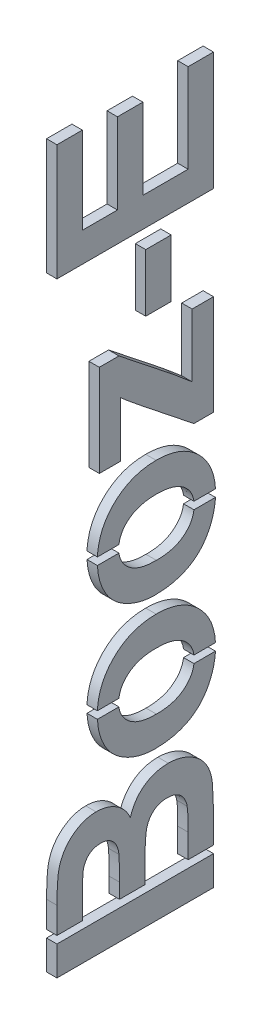
from build123d import *

# Parameters (mm, degrees)
SKETCH1_W             = 500
SKETCH1_H             = 100
SKETCH1_R             = 2.8
BOSS_EXTRUDE1_DEPTH   = 3.175
SKETCH2_W             = 17.846153846
SKETCH2_H             = 8
CUT_EXTRUDE1_DEPTH    = 255.970744645
SKETCH3_W             = 2
SKETCH3_H             = 48
SKETCH3_H_2           = 36.268634567
SKETCH3_H_3           = 36.26116394
BOSS_EXTRUDE4_DEPTH   = 3.175
SKETCH9_W             = 506.35
SKETCH9_H             = 106.35
SKETCH9_W_2           = 500
SKETCH9_H_2           = 100
BOSS_EXTRUDE5_DEPTH   = 3.175
SKETCH10_W            = 8.980769231
SKETCH10_H            = 47.75
BOSS_EXTRUDE6_DEPTH   = 3.175
BOSS_EXTRUDE6_2_DEPTH = 3.175
BOSS_EXTRUDE6_3_DEPTH = 3.175
BOSS_EXTRUDE6_4_DEPTH = 3.175
BOSS_EXTRUDE6_5_DEPTH = 3.175
BOSS_EXTRUDE6_6_DEPTH = 3.175
BOSS_EXTRUDE6_7_DEPTH = 3.175
SKETCH10_W_2          = 17.596153846
SKETCH10_H_2          = 7.75
BOSS_EXTRUDE6_8_DEPTH = 3.175
BOSS_EXTRUDE6_9_DEPTH = 3.175
SKETCH11_W            = 506.35
SKETCH11_H            = 106.35
SKETCH11_R            = 2.8
SKETCH11_W_2          = 17.846153846
SKETCH11_H_2          = 8
SKETCH11_W_3          = 9.230769231
SKETCH11_H_3          = 48
CUT_EXTRUDE2_DEPTH    = 259.718460758


with BuildPart() as part:
    # Sketch1 → Boss-Extrude1 (new body)
    with BuildSketch(Plane.YZ):
        Rectangle(SKETCH1_W, SKETCH1_H)
        with Locations(Location((-237.5, 37.5, 0), (0, 0, 270))):
            Circle(SKETCH1_R, mode=Mode.SUBTRACT)
        with Locations(Location((237.5, 37.5, 0), (0, 0, 90))):
            Circle(SKETCH1_R, mode=Mode.SUBTRACT)
        with Locations(Location((237.5, -37.5, 0), (0, 0, 270))):
            Circle(SKETCH1_R, mode=Mode.SUBTRACT)
        with Locations(Location((-237.5, -37.5, 0), (0, 0, 90))):
            Circle(SKETCH1_R, mode=Mode.SUBTRACT)
    extrude(amount=BOSS_EXTRUDE1_DEPTH)

    # Sketch2 → Cut-Extrude1 (cut, through all)
    # profile 1 of 6: a face of its own
    with BuildSketch(Plane.YZ.offset(3.175)):
        with BuildLine():
            Line((-210.076923077, 24), (-190.740384615, 24))
            add(Edge.make_bspline(
                [(-190.740384615, 24), (-189.843065051, 23.991908422), (-188.541064106, 23.993595131), (-186.868498546, 23.933344815), (-185.751963701, 23.895772861), (-184.730714073, 23.808020187), (-183.796726838, 23.739065687), (-182.952941804, 23.644206104), (-181.958941097, 23.490694087), (-180.803093852, 23.25191728), (-179.497592609, 22.810244633), (-178.260105749, 22.258417898), (-177.109232418, 21.556854635), (-176.041155113, 20.736332317), (-175.047684639, 19.803386409), (-174.174725455, 18.720317621), (-173.388402473, 17.538231121), (-172.725582471, 16.256137431), (-172.104890848, 14.393697304), (-171.921755444, 12.917736382), (-171.923076923, 11.923076923)],
                knots=[0, 0, 0, 0, 0.105884058, 0.15355278, 0.1974569, 0.237652956, 0.27445636, 0.307946195, 0.337787549, 0.393116516, 0.446925741, 0.500063811, 0.55265689, 0.60552249, 0.65874794, 0.713022825, 0.769236291, 0.82605694, 0.882736495, 1, 1, 1, 1], degree=3))
            add(Edge.make_bspline(
                [(-171.923076923, 11.923076923), (-171.915463906, 10.83301428), (-172.131712608, 9.202251646), (-172.869977029, 7.150731131), (-173.641339074, 5.714556228), (-174.588002252, 4.397681844), (-176.083139801, 2.845306621), (-177.447085264, 1.961092084), (-178.423076923, 1.509615385)],
                knots=[0, 0, 0, 0, 0.252157198, 0.376787363, 0.502925804, 0.62834201, 0.751131965, 1, 1, 1, 1], degree=3))
            add(Edge.make_bspline(
                [(-178.423076923, 1.509615385), (-177.777213356, 1.300151904), (-176.835669325, 0.941665951), (-175.670426869, 0.310338052), (-174.865992928, -0.205727581), (-174.114016682, -0.775352096), (-173.436393921, -1.417126022), (-172.794261967, -2.094613585), (-172.230518786, -2.84180196), (-171.720245482, -3.62295956), (-171.287097745, -4.450312253), (-170.91203502, -5.303958159), (-170.598336433, -6.192545318), (-170.374823195, -7.122000494), (-170.132722876, -8.415226734), (-170.090556654, -9.416126066), (-170.076923077, -10.086538462)],
                knots=[0, 0, 0, 0, 0.132556806, 0.195780264, 0.258216645, 0.318868125, 0.379477695, 0.440087264, 0.500738744, 0.56178533, 0.621918965, 0.682673484, 0.743575816, 0.805446126, 0.868974916, 1, 1, 1, 1], degree=3))
            add(Edge.make_bspline(
                [(-170.076923077, -10.086538462), (-170.083387247, -11.168561109), (-170.260616987, -12.808233718), (-170.90973872, -14.915330857), (-171.567710797, -16.463795065), (-172.386064411, -17.923894815), (-173.347888701, -19.256972165), (-174.470159676, -20.416821755), (-175.712942024, -21.439033269), (-177.113444272, -22.284468613), (-179.246749997, -23.178717765), (-180.989181459, -23.547596545), (-182.192307692, -23.673076923)],
                knots=[0, 0, 0, 0, 0.162134877, 0.244884357, 0.329396712, 0.41363605, 0.495043982, 0.574816901, 0.654648996, 0.735397766, 0.818838922, 1, 1, 1, 1], degree=3))
            add(Edge.make_bspline(
                [(-182.192307692, -23.673076923), (-182.736401215, -23.721395628), (-183.659076965, -23.787343646), (-185.031960642, -23.839150157), (-186.377926038, -23.890296562), (-187.938972286, -23.92702317), (-190.445451747, -23.963097063), (-192.432556734, -23.995709696), (-193.826923077, -24)],
                knots=[0, 0, 0, 0, 0.140766497, 0.238315848, 0.354022328, 0.487866729, 0.640687248, 1, 1, 1, 1], degree=3))
            Line((-193.826923077, -24), (-210.076923077, -24))
            Line((-210.076923077, -24), (-210.076923077, 24))
        make_face()
        with BuildLine():
            Line((-200.846153846, 16), (-200.846153846, 4.923076923))
            Line((-200.846153846, 4.923076923), (-194.163461538, 4.923076923))
            add(Edge.make_bspline(
                [(-194.163461538, 4.923076923), (-193.265983194, 4.915875878), (-191.990379912, 4.930337661), (-190.381340573, 4.93957842), (-189.384426502, 4.957564307), (-188.528734942, 4.987827365), (-187.672570496, 5.022841349), (-187.101425884, 5.048184339), (-186.769230769, 5.086538462)],
                knots=[0, 0, 0, 0, 0.363928509, 0.517301829, 0.652498452, 0.768239873, 0.864498693, 1, 1, 1, 1], degree=3))
            add(Edge.make_bspline(
                [(-186.769230769, 5.086538462), (-185.972953689, 5.18854668), (-184.810246839, 5.423950166), (-183.466913625, 6.131329055), (-182.634617275, 6.765255192), (-181.974579307, 7.543321504), (-181.309564485, 8.766521054), (-181.15885995, 9.829927363), (-181.153846154, 10.538461538)],
                knots=[0, 0, 0, 0, 0.279180569, 0.403146506, 0.522444612, 0.638838486, 0.753412678, 1, 1, 1, 1], degree=3))
            add(Edge.make_bspline(
                [(-181.153846154, 10.538461538), (-181.136832253, 11.22485139), (-181.29957954, 12.228650878), (-181.851571254, 13.428065696), (-182.434368937, 14.180691445), (-183.166681173, 14.816013153), (-184.419123766, 15.511045966), (-185.521816808, 15.731898255), (-186.278846154, 15.836538462)],
                knots=[0, 0, 0, 0, 0.250585524, 0.366013953, 0.47979182, 0.596199355, 0.718553119, 1, 1, 1, 1], degree=3))
            add(Edge.make_bspline(
                [(-186.278846154, 15.836538462), (-186.649529401, 15.876182244), (-187.294411246, 15.900453364), (-188.272324581, 15.935602406), (-189.272274829, 15.965626343), (-190.451863343, 15.983563344), (-192.378201793, 15.992746418), (-193.910220111, 16.007323291), (-194.990384615, 16)],
                knots=[0, 0, 0, 0, 0.128239885, 0.22208111, 0.336874893, 0.472602106, 0.628175186, 1, 1, 1, 1], degree=3))
            Line((-194.990384615, 16), (-200.846153846, 16))
        make_face(mode=Mode.SUBTRACT)
        with BuildLine():
            Line((-200.846153846, -3.076923077), (-200.846153846, -16))
            Line((-200.846153846, -16), (-191.423076923, -16))
            add(Edge.make_bspline(
                [(-191.423076923, -16), (-190.589503001, -16.015748033), (-189.400718209, -15.983284976), (-187.900229721, -15.969355508), (-186.961462853, -15.923986242), (-186.150260652, -15.88941373), (-185.317440608, -15.837620903), (-184.761249255, -15.756701108), (-184.432692308, -15.701923077)],
                knots=[0, 0, 0, 0, 0.356994199, 0.509418466, 0.642709622, 0.759541115, 0.857263317, 1, 1, 1, 1], degree=3))
            add(Edge.make_bspline(
                [(-184.432692308, -15.701923077), (-183.715416128, -15.586736145), (-182.688788528, -15.243238653), (-181.48217853, -14.497736793), (-180.712682663, -13.796744773), (-180.080988572, -12.956079881), (-179.448282758, -11.602091364), (-179.303535085, -10.451583543), (-179.307692308, -9.673076923)],
                knots=[0, 0, 0, 0, 0.250407824, 0.369282527, 0.487614715, 0.607842641, 0.730167532, 1, 1, 1, 1], degree=3))
            add(Edge.make_bspline(
                [(-179.307692308, -9.673076923), (-179.303593697, -8.992433722), (-179.427094789, -7.990636237), (-179.907580148, -6.769709557), (-180.394269917, -5.966106516), (-181.0030541, -5.242186838), (-181.755439529, -4.636375985), (-182.624137062, -4.131638431), (-183.452249399, -3.79912359), (-184.237517489, -3.585795337), (-184.98649789, -3.445848029), (-185.889172396, -3.335068231), (-186.941165418, -3.241365007), (-188.146742353, -3.166412878), (-190.056704665, -3.083302486), (-191.567391388, -3.081828146), (-192.625, -3.076923077)],
                knots=[0, 0, 0, 0, 0.12069588, 0.176255416, 0.231266923, 0.286442241, 0.34292522, 0.401445762, 0.463857631, 0.500356262, 0.54545082, 0.598687676, 0.661395797, 0.732507568, 0.812630315, 1, 1, 1, 1], degree=3))
            Line((-192.625, -3.076923077), (-200.846153846, -3.076923077))
        make_face(mode=Mode.SUBTRACT)
    # profile 2 of 6: a face of its own
    with BuildSketch(Plane.YZ.offset(3.175)):
        with BuildLine():
            Line((-84.538461538, -24), (-84.538461538, -17.846153846))
            Line((-84.538461538, -17.846153846), (-71.461538462, -1.413461538))
            add(Edge.make_bspline(
                [(-71.461538462, -1.413461538), (-70.968680564, -0.783264098), (-70.229006889, 0.104293194), (-69.301040807, 1.258289535), (-68.671014533, 2.004691465), (-68.108534999, 2.690928269), (-67.453655346, 3.449844943), (-66.989223126, 3.98220471), (-66.692307692, 4.307692308)],
                knots=[0, 0, 0, 0, 0.322142125, 0.465272934, 0.596329707, 0.715487367, 0.822590745, 1, 1, 1, 1], degree=3))
            add(Edge.make_bspline(
                [(-66.692307692, 4.307692308), (-67.314102564, 4.307692308), (-68.730769231, 4.307692308), (-70.147435897, 4.307692308), (-70.942307692, 4.307692308)],
                knots=[0, 0, 0, 0, 0.438914027, 1, 1, 1, 1], degree=3))
            Line((-70.942307692, 4.307692308), (-83.307692308, 4.307692308))
            Line((-83.307692308, 4.307692308), (-83.307692308, 11.076923077))
            Line((-83.307692308, 11.076923077), (-55, 11.076923077))
            Line((-55, 11.076923077), (-55, 4.923076923))
            Line((-55, 4.923076923), (-68.201923077, -11.721153846))
            Line((-68.201923077, -11.721153846), (-72.846153846, -17.230769231))
            add(Edge.make_bspline(
                [(-72.846153846, -17.230769231), (-72.266025641, -17.230769231), (-71.442307692, -17.230769231), (-70.403846154, -17.230769231), (-69.762820513, -17.230769231), (-69.211538462, -17.230769231), (-68.66025641, -17.230769231), (-68.291666667, -17.230769231), (-68.076923077, -17.230769231)],
                knots=[0, 0, 0, 0, 0.364919355, 0.518145161, 0.653225806, 0.768145161, 0.864919355, 1, 1, 1, 1], degree=3))
            Line((-68.076923077, -17.230769231), (-53.769230769, -17.230769231))
            Line((-53.769230769, -17.230769231), (-53.769230769, -24))
            Line((-53.769230769, -24), (-84.538461538, -24))
        make_face()
    # profile 3 of 6: a face of its own
    with BuildSketch(Plane.YZ.offset(3.175)):
        with Locations((-39.923076923, -7.076923077)):
            Rectangle(SKETCH2_W, SKETCH2_H)
    # profile 4 of 6: a face of its own
    with BuildSketch(Plane.YZ.offset(3.175)):
        Polygon((-25.461538462, -24), (-25.461538462, 24), (10.230769231, 24), (10.230769231, 16), (-16.230769231, 16), (-16.230769231, 5.538461538), (8.384615385, 5.538461538), (8.384615385, -2.461538462), (-16.230769231, -2.461538462), (-16.230769231, -16), (10.846153846, -16), (10.846153846, -24), align=None)
    # profile 5 of 6: a face of its own
    with BuildSketch(Plane.YZ.offset(3.175)):
        with BuildLine():
            add(Edge.make_bspline(
                [(-164.538461538, -5.971153846), (-164.525361513, -4.455317517), (-164.264537148, -2.163281886), (-163.308424405, 0.768298631), (-162.506991494, 2.560706395), (-161.714608168, 3.931023491), (-161.074833513, 4.919161747), (-160.360560995, 5.833066706), (-159.586448881, 6.678528358), (-158.769900339, 7.475815535), (-157.882166293, 8.195598007), (-156.934727536, 8.850278632), (-155.936835264, 9.447080268), (-154.889915965, 9.971086615), (-153.813405996, 10.436881562), (-152.702954653, 10.819583971), (-151.566300484, 11.137041797), (-150.398508466, 11.391313875), (-148.782959781, 11.617279135), (-147.550099305, 11.69127361), (-146.721153846, 11.692307692)],
                knots=[0, 0, 0, 0, 0.162140998, 0.244134843, 0.328745059, 0.371396388, 0.413193452, 0.454436775, 0.495169251, 0.535619967, 0.576273169, 0.617126418, 0.658595237, 0.700410539, 0.742144409, 0.783845942, 0.825811058, 0.868198922, 0.911452437, 1, 1, 1, 1], degree=3))
            add(Edge.make_bspline(
                [(-146.721153846, 11.692307692), (-145.465977639, 11.693835962), (-143.610306528, 11.55308647), (-141.239017431, 11.003471329), (-139.57908794, 10.442622985), (-138.006240805, 9.722838028), (-136.528418468, 8.828367842), (-135.133403514, 7.785232057), (-133.847599993, 6.587128465), (-132.672320476, 5.275273204), (-131.652994744, 3.857035149), (-130.783044963, 2.359847037), (-130.062318961, 0.781331629), (-129.516050354, -0.886851381), (-129.00008891, -3.265228826), (-128.8360265, -5.11179234), (-128.846153846, -6.365384615)],
                knots=[0, 0, 0, 0, 0.132301244, 0.195046012, 0.256021148, 0.316610756, 0.376897544, 0.437680691, 0.499809068, 0.561756395, 0.622955533, 0.683480177, 0.743929412, 0.805438003, 0.868033569, 1, 1, 1, 1], degree=3))
            add(Edge.make_bspline(
                [(-128.846153846, -6.365384615), (-128.838109068, -7.628073955), (-128.994839504, -9.492650718), (-129.525674058, -11.892357564), (-130.083142704, -13.577431468), (-130.802314715, -15.176396851), (-131.668485871, -16.694712098), (-132.70487118, -18.12439292), (-133.891530307, -19.450539706), (-135.19394404, -20.655199223), (-136.578940332, -21.726138324), (-138.063232002, -22.608966719), (-139.620782465, -23.351553883), (-141.267613718, -23.914256311), (-143.607339921, -24.462382631), (-145.428900561, -24.627527689), (-146.663461538, -24.615384615)],
                knots=[0, 0, 0, 0, 0.132664632, 0.195844471, 0.25795447, 0.318876286, 0.379842798, 0.441368954, 0.504122503, 0.56658146, 0.627628899, 0.687774491, 0.747753793, 0.808695168, 0.870308884, 1, 1, 1, 1], degree=3))
            add(Edge.make_bspline(
                [(-146.663461538, -24.615384615), (-148.224872266, -24.615861531), (-150.569113031, -24.349132398), (-153.574905536, -23.440786781), (-155.391067893, -22.662353022), (-156.778426398, -21.902162992), (-157.762303945, -21.262398306), (-158.690188927, -20.57577744), (-159.540370024, -19.807029757), (-160.327520426, -18.978218676), (-161.062067726, -18.097371864), (-161.717857085, -17.144156698), (-162.313206047, -16.135891562), (-162.847418632, -15.065369867), (-163.292766191, -13.92965059), (-163.679674279, -12.742073895), (-163.998851145, -11.499941745), (-164.235257512, -10.197933099), (-164.470167793, -8.353368236), (-164.535010955, -6.934047616), (-164.538461538, -5.971153846)],
                knots=[0, 0, 0, 0, 0.160511599, 0.240687016, 0.322168434, 0.363171868, 0.403209087, 0.442755033, 0.481726967, 0.520886552, 0.560212184, 0.599521244, 0.639706025, 0.680530285, 0.722388267, 0.765012415, 0.808893272, 0.854138877, 0.900982465, 1, 1, 1, 1], degree=3))
        make_face()
        with BuildLine():
            add(Edge.make_bspline(
                [(-155.307692308, -6.461538462), (-155.309052621, -7.32906199), (-155.238496188, -8.596139064), (-154.984773481, -10.22237118), (-154.70101741, -11.319716252), (-154.358471789, -12.343949535), (-153.923741539, -13.281448383), (-153.426962922, -14.149967862), (-152.835746517, -14.917020018), (-152.191376769, -15.596012636), (-151.516014558, -16.19934303), (-150.803037583, -16.71304933), (-150.048058922, -17.130796747), (-149.252040745, -17.447600841), (-148.136359479, -17.762599412), (-147.259542964, -17.840735718), (-146.673076923, -17.846153846)],
                knots=[0, 0, 0, 0, 0.162282734, 0.237014737, 0.307558049, 0.374124876, 0.438795352, 0.500611131, 0.560942973, 0.619486829, 0.675564498, 0.730150481, 0.783564296, 0.836572585, 0.890117536, 1, 1, 1, 1], degree=3))
            add(Edge.make_bspline(
                [(-146.673076923, -17.846153846), (-146.086416968, -17.841215563), (-145.210167854, -17.76167521), (-144.096438585, -17.449745751), (-143.305572416, -17.128207375), (-142.552548071, -16.713427991), (-141.840014813, -16.198999325), (-141.165139764, -15.598501089), (-140.526009944, -14.915845202), (-139.951898527, -14.138348546), (-139.450252193, -13.272540339), (-139.015533992, -12.33145315), (-138.67141092, -11.301785869), (-138.403199784, -10.191817138), (-138.143126798, -8.551855675), (-138.076617205, -7.271010511), (-138.076923077, -6.394230769)],
                knots=[0, 0, 0, 0, 0.109603407, 0.163012375, 0.215331594, 0.26860976, 0.323057116, 0.37899237, 0.436978637, 0.497276061, 0.558934853, 0.623441092, 0.690404991, 0.761205129, 0.836337828, 1, 1, 1, 1], degree=3))
            add(Edge.make_bspline(
                [(-138.076923077, -6.394230769), (-138.077306172, -5.536811351), (-138.141641272, -4.284122394), (-138.405766296, -2.677176681), (-138.66935341, -1.585271347), (-139.017319447, -0.569468954), (-139.452974194, 0.360822605), (-139.948600098, 1.224111258), (-140.529365853, 1.993471995), (-141.164733849, 2.675723073), (-141.840118827, 3.275845808), (-142.552521163, 3.790370883), (-143.305579409, 4.205125302), (-144.096436692, 4.526670222), (-145.210169164, 4.838597323), (-146.086416288, 4.918139141), (-146.673076923, 4.923076923)],
                knots=[0, 0, 0, 0, 0.16138657, 0.235346324, 0.306137922, 0.372506886, 0.436991515, 0.499153027, 0.559458553, 0.617917599, 0.674308908, 0.729200189, 0.782912747, 0.835658539, 0.889502966, 1, 1, 1, 1], degree=3))
            add(Edge.make_bspline(
                [(-146.673076923, 4.923076923), (-147.259542964, 4.917658794), (-148.136359479, 4.839522489), (-149.252040745, 4.524523918), (-150.048058922, 4.207719824), (-150.803037583, 3.789972407), (-151.516014558, 3.276266107), (-152.191376769, 2.672935713), (-152.835746517, 1.993943095), (-153.426962922, 1.226890939), (-153.923741539, 0.35837146), (-154.358471789, -0.579127388), (-154.70101741, -1.603360671), (-154.984773481, -2.700705743), (-155.238496188, -4.326937859), (-155.309052621, -5.594014933), (-155.307692308, -6.461538462)],
                knots=[0, 0, 0, 0, 0.109882464, 0.163427415, 0.216435704, 0.269849519, 0.324435502, 0.380513171, 0.439057027, 0.499388869, 0.561204648, 0.625875124, 0.692441951, 0.762985263, 0.837717266, 1, 1, 1, 1], degree=3))
        make_face(mode=Mode.SUBTRACT)
    # profile 6 of 6: a face of its own
    with BuildSketch(Plane.YZ.offset(3.175)):
        with BuildLine():
            add(Edge.make_bspline(
                [(-123.923076923, -5.971153846), (-123.909976897, -4.455317517), (-123.649152532, -2.163281886), (-122.69303979, 0.768298631), (-121.891606879, 2.560706395), (-121.099223553, 3.931023491), (-120.459448898, 4.919161747), (-119.745176379, 5.833066706), (-118.971064266, 6.678528358), (-118.154515723, 7.475815535), (-117.266781678, 8.195598007), (-116.31934292, 8.850278632), (-115.321450649, 9.447080268), (-114.27453135, 9.971086615), (-113.198021381, 10.436881562), (-112.087570038, 10.819583971), (-110.950915869, 11.137041797), (-109.783123851, 11.391313875), (-108.167575165, 11.617279135), (-106.934714689, 11.69127361), (-106.105769231, 11.692307692)],
                knots=[0, 0, 0, 0, 0.162140998, 0.244134843, 0.328745059, 0.371396388, 0.413193452, 0.454436775, 0.495169251, 0.535619967, 0.576273169, 0.617126418, 0.658595237, 0.700410539, 0.742144409, 0.783845942, 0.825811058, 0.868198922, 0.911452437, 1, 1, 1, 1], degree=3))
            add(Edge.make_bspline(
                [(-106.105769231, 11.692307692), (-104.850593024, 11.693835962), (-102.994921913, 11.55308647), (-100.623632816, 11.003471329), (-98.963703324, 10.442622985), (-97.390856189, 9.722838028), (-95.913033852, 8.828367842), (-94.518018899, 7.785232057), (-93.232215378, 6.587128465), (-92.056935861, 5.275273204), (-91.037610129, 3.857035149), (-90.167660348, 2.359847037), (-89.446934346, 0.781331629), (-88.900665739, -0.886851381), (-88.384704295, -3.265228826), (-88.220641884, -5.11179234), (-88.230769231, -6.365384615)],
                knots=[0, 0, 0, 0, 0.132301244, 0.195046012, 0.256021148, 0.316610756, 0.376897544, 0.437680691, 0.499809068, 0.561756395, 0.622955533, 0.683480177, 0.743929412, 0.805438003, 0.868033569, 1, 1, 1, 1], degree=3))
            add(Edge.make_bspline(
                [(-88.230769231, -6.365384615), (-88.222724453, -7.628073955), (-88.379454888, -9.492650718), (-88.910289443, -11.892357564), (-89.467758089, -13.577431468), (-90.1869301, -15.176396851), (-91.053101255, -16.694712098), (-92.089486564, -18.12439292), (-93.276145691, -19.450539706), (-94.578559425, -20.655199223), (-95.963555717, -21.726138324), (-97.447847386, -22.608966719), (-99.00539785, -23.351553883), (-100.652229103, -23.914256311), (-102.991955306, -24.462382631), (-104.813515946, -24.627527689), (-106.048076923, -24.615384615)],
                knots=[0, 0, 0, 0, 0.132664632, 0.195844471, 0.25795447, 0.318876286, 0.379842798, 0.441368954, 0.504122503, 0.56658146, 0.627628899, 0.687774491, 0.747753793, 0.808695168, 0.870308884, 1, 1, 1, 1], degree=3))
            add(Edge.make_bspline(
                [(-106.048076923, -24.615384615), (-107.60948765, -24.615861531), (-109.953728415, -24.349132398), (-112.959520921, -23.440786781), (-114.775683278, -22.662353022), (-116.163041782, -21.902162992), (-117.146919329, -21.262398306), (-118.074804312, -20.57577744), (-118.924985409, -19.807029757), (-119.712135811, -18.978218676), (-120.44668311, -18.097371864), (-121.10247247, -17.144156698), (-121.697821432, -16.135891562), (-122.232034016, -15.065369867), (-122.677381575, -13.92965059), (-123.064289663, -12.742073895), (-123.383466529, -11.499941745), (-123.619872896, -10.197933099), (-123.854783178, -8.353368236), (-123.919626339, -6.934047616), (-123.923076923, -5.971153846)],
                knots=[0, 0, 0, 0, 0.160511599, 0.240687016, 0.322168434, 0.363171868, 0.403209087, 0.442755033, 0.481726967, 0.520886552, 0.560212184, 0.599521244, 0.639706025, 0.680530285, 0.722388267, 0.765012415, 0.808893272, 0.854138877, 0.900982465, 1, 1, 1, 1], degree=3))
        make_face()
        with BuildLine():
            add(Edge.make_bspline(
                [(-114.692307692, -6.461538462), (-114.693668006, -7.32906199), (-114.623111573, -8.596139064), (-114.369388865, -10.22237118), (-114.085632794, -11.319716252), (-113.743087174, -12.343949535), (-113.308356923, -13.281448383), (-112.811578307, -14.149967862), (-112.220361902, -14.917020018), (-111.575992154, -15.596012636), (-110.900629943, -16.19934303), (-110.187652968, -16.71304933), (-109.432674307, -17.130796747), (-108.636656129, -17.447600841), (-107.520974864, -17.762599412), (-106.644158348, -17.840735718), (-106.057692308, -17.846153846)],
                knots=[0, 0, 0, 0, 0.162282734, 0.237014737, 0.307558049, 0.374124876, 0.438795352, 0.500611131, 0.560942973, 0.619486829, 0.675564498, 0.730150481, 0.783564296, 0.836572585, 0.890117536, 1, 1, 1, 1], degree=3))
            add(Edge.make_bspline(
                [(-106.057692308, -17.846153846), (-105.471032353, -17.841215563), (-104.594783239, -17.76167521), (-103.481053969, -17.449745751), (-102.690187801, -17.128207375), (-101.937163455, -16.713427991), (-101.224630198, -16.198999325), (-100.549755149, -15.598501089), (-99.910625329, -14.915845202), (-99.336513912, -14.138348546), (-98.834867577, -13.272540339), (-98.400149376, -12.33145315), (-98.056026304, -11.301785869), (-97.787815169, -10.191817138), (-97.527742182, -8.551855675), (-97.46123259, -7.271010511), (-97.461538462, -6.394230769)],
                knots=[0, 0, 0, 0, 0.109603407, 0.163012375, 0.215331594, 0.26860976, 0.323057116, 0.37899237, 0.436978637, 0.497276061, 0.558934853, 0.623441092, 0.690404991, 0.761205129, 0.836337828, 1, 1, 1, 1], degree=3))
            add(Edge.make_bspline(
                [(-97.461538462, -6.394230769), (-97.461921557, -5.536811351), (-97.526256656, -4.284122394), (-97.790381681, -2.677176681), (-98.053968795, -1.585271347), (-98.401934831, -0.569468954), (-98.837589578, 0.360822605), (-99.333215483, 1.224111258), (-99.913981238, 1.993471995), (-100.549349233, 2.675723073), (-101.224734212, 3.275845808), (-101.937136547, 3.790370883), (-102.690194794, 4.205125302), (-103.481052077, 4.526670222), (-104.594784548, 4.838597323), (-105.471031673, 4.918139141), (-106.057692308, 4.923076923)],
                knots=[0, 0, 0, 0, 0.16138657, 0.235346324, 0.306137922, 0.372506886, 0.436991515, 0.499153027, 0.559458553, 0.617917599, 0.674308908, 0.729200189, 0.782912747, 0.835658539, 0.889502966, 1, 1, 1, 1], degree=3))
            add(Edge.make_bspline(
                [(-106.057692308, 4.923076923), (-106.644158348, 4.917658794), (-107.520974864, 4.839522489), (-108.636656129, 4.524523918), (-109.432674307, 4.207719824), (-110.187652968, 3.789972407), (-110.900629943, 3.276266107), (-111.575992154, 2.672935713), (-112.220361902, 1.993943095), (-112.811578307, 1.226890939), (-113.308356923, 0.35837146), (-113.743087174, -0.579127388), (-114.085632794, -1.603360671), (-114.369388865, -2.700705743), (-114.623111573, -4.326937859), (-114.693668006, -5.594014933), (-114.692307692, -6.461538462)],
                knots=[0, 0, 0, 0, 0.109882464, 0.163427415, 0.216435704, 0.269849519, 0.324435502, 0.380513171, 0.439057027, 0.499388869, 0.561204648, 0.625875124, 0.692441951, 0.762985263, 0.837717266, 1, 1, 1, 1], degree=3))
        make_face(mode=Mode.SUBTRACT)
    extrude(amount=-CUT_EXTRUDE1_DEPTH, mode=Mode.SUBTRACT)


with BuildPart() as cut_extrude1_piece_1:
    # of the separate pieces the step leaves, piece 1, a body of its own (cut_extrude1_pieces)
    add(part.part.solids().sort_by_distance((0, -250, -50))[0])



with BuildPart() as cut_extrude1_piece_2:
    # of the separate pieces the step leaves, piece 2, a body of its own (cut_extrude1_pieces)
    add(part.part.solids().sort_by_distance((0, -106.057692308, -17.846153846))[0])


with BuildPart() as cut_extrude1_piece_3:
    # of the separate pieces the step leaves, piece 3, a body of its own (cut_extrude1_pieces)
    add(part.part.solids().sort_by_distance((0, -146.673076923, -17.846153846))[0])


with BuildPart() as cut_extrude1_piece_4:
    # of the separate pieces the step leaves, piece 4, a body of its own (cut_extrude1_pieces)
    add(part.part.solids().sort_by_distance((0, -192.625, -3.076923077))[0])


with BuildPart() as cut_extrude1_piece_5:
    # of the separate pieces the step leaves, piece 5, a body of its own (cut_extrude1_pieces)
    add(part.part.solids().sort_by_distance((0, -194.990384615, 16))[0])


with BuildPart() as cut_extrude1_piece_1_1:
    add(cut_extrude1_piece_1.part)

    add(cut_extrude1_piece_2.part)  # Boss-Extrude4 merges Cut-Extrude1 piece 2

    add(cut_extrude1_piece_3.part)  # Boss-Extrude4 merges Cut-Extrude1 piece 3

    add(cut_extrude1_piece_4.part)  # Boss-Extrude4 merges Cut-Extrude1 piece 4

    add(cut_extrude1_piece_5.part)  # Boss-Extrude4 merges Cut-Extrude1 piece 5
    # Sketch3 → Boss-Extrude4 (add, through all)
    with BuildSketch(Plane.YZ.offset(3.175)):
        with Locations((-199.846153846, 0)):
            Rectangle(SKETCH3_W, SKETCH3_H)
        with Locations((-146.673076923, -6.464343088)):
            Rectangle(SKETCH3_W, SKETCH3_H_2)
        with Locations((-106.057692308, -6.460196748)):
            Rectangle(SKETCH3_W, SKETCH3_H_3)
    extrude(amount=-BOSS_EXTRUDE4_DEPTH)

    # Sketch9 → Boss-Extrude5 (add, through all)
    with BuildSketch(Plane.YZ.offset(3.175)):
        Rectangle(SKETCH9_W, SKETCH9_H)
        Rectangle(SKETCH9_W_2, SKETCH9_H_2, mode=Mode.SUBTRACT)
    extrude(amount=-BOSS_EXTRUDE5_DEPTH)

    # Sketch11 → Cut-Extrude2 (cut, through all)
    with BuildSketch(Plane.YZ.offset(3.175)):
        Rectangle(SKETCH11_W, SKETCH11_H)
        with Locations((-237.5, -37.5)):
            Circle(SKETCH11_R, mode=Mode.SUBTRACT)
        with Locations((237.5, 37.5)):
            Circle(SKETCH11_R, mode=Mode.SUBTRACT)
        with Locations((-237.5, 37.5)):
            Circle(SKETCH11_R, mode=Mode.SUBTRACT)
        with Locations((237.5, -37.5)):
            Circle(SKETCH11_R, mode=Mode.SUBTRACT)
        with BuildLine():
            Line((-147.673076923, 4.863517403), (-147.673076923, 11.669974196))
            add(Edge.make_bspline(
                [(-147.673076923, 11.669974196), (-148.183854796, 11.646774057), (-149.097495463, 11.573285328), (-150.398508466, 11.391313875), (-151.566300484, 11.137041797), (-152.702954653, 10.819583971), (-153.813405996, 10.436881562), (-154.889915965, 9.971086615), (-155.936835264, 9.447080268), (-156.934727536, 8.850278632), (-157.882166293, 8.195598007), (-158.769900339, 7.475815535), (-159.586448881, 6.678528358), (-160.360560995, 5.833066706), (-161.074833513, 4.919161747), (-161.714608168, 3.931023491), (-162.506991494, 2.560706395), (-163.308424405, 0.768298631), (-164.264537148, -2.163281886), (-164.525361513, -4.455317517), (-164.538461538, -5.971153846)],
                knots=[0, 0, 0, 0, 0.056552102, 0.101323981, 0.145199821, 0.188638072, 0.231803488, 0.275002376, 0.318285555, 0.361210088, 0.403497442, 0.445577727, 0.487448418, 0.529610758, 0.57230188, 0.61556618, 0.659714734, 0.747295092, 0.832167233, 1, 1, 1, 1], degree=3))
            add(Edge.make_bspline(
                [(-164.538461538, -5.971153846), (-164.535010955, -6.934047616), (-164.470167793, -8.353368236), (-164.235257512, -10.197933099), (-163.998851145, -11.499941745), (-163.679674279, -12.742073895), (-163.292766191, -13.92965059), (-162.847418632, -15.065369867), (-162.313206047, -16.135891562), (-161.717857085, -17.144156698), (-161.062067726, -18.097371864), (-160.327520426, -18.978218676), (-159.540370024, -19.807029757), (-158.690188927, -20.57577744), (-157.762303945, -21.262398306), (-156.778426398, -21.902162992), (-155.391067893, -22.662353022), (-153.574905536, -23.440786781), (-150.891948444, -24.25157206), (-148.896871631, -24.530656123), (-147.673076923, -24.590778718)],
                knots=[0, 0, 0, 0, 0.102566576, 0.151089158, 0.197956481, 0.243410139, 0.287562045, 0.330920325, 0.37320783, 0.414832936, 0.455550933, 0.496286096, 0.53684926, 0.577218048, 0.618181421, 0.659653676, 0.702126778, 0.786528698, 0.869577806, 1, 1, 1, 1], degree=3))
            Line((-147.673076923, -24.590778718), (-147.673076923, -17.786594326))
            add(Edge.make_bspline(
                [(-147.673076923, -17.786594326), (-147.924973028, -17.757643261), (-148.458442284, -17.671663384), (-149.252040745, -17.447600841), (-150.048058922, -17.130796747), (-150.803037583, -16.71304933), (-151.516014558, -16.19934303), (-152.191376769, -15.596012636), (-152.835746517, -14.917020018), (-153.426962922, -14.149967862), (-153.923741539, -13.281448383), (-154.358471789, -12.343949535), (-154.70101741, -11.319716252), (-154.984773481, -10.22237118), (-155.238496188, -8.596139064), (-155.309052621, -7.32906199), (-155.307692308, -6.461538462)],
                knots=[0, 0, 0, 0, 0.050559323, 0.107672853, 0.164213954, 0.221187609, 0.279411551, 0.339226595, 0.40167219, 0.466024933, 0.531960512, 0.600941043, 0.67194431, 0.747189081, 0.826901703, 1, 1, 1, 1], degree=3))
            add(Edge.make_bspline(
                [(-155.307692308, -6.461538462), (-155.309052621, -5.594014933), (-155.238496188, -4.326937859), (-154.984773481, -2.700705743), (-154.70101741, -1.603360671), (-154.358471789, -0.579127388), (-153.923741539, 0.35837146), (-153.426962922, 1.226890939), (-152.835746517, 1.993943095), (-152.191376769, 2.672935713), (-151.516014558, 3.276266107), (-150.803037583, 3.789972407), (-150.048058922, 4.207719824), (-149.252040745, 4.524523918), (-148.458442284, 4.748586461), (-147.924973028, 4.834566338), (-147.673076923, 4.863517403)],
                knots=[0, 0, 0, 0, 0.173098297, 0.252810919, 0.32805569, 0.399058957, 0.468039488, 0.533975067, 0.59832781, 0.660773405, 0.720588449, 0.778812391, 0.835786046, 0.892327147, 0.949440677, 1, 1, 1, 1], degree=3))
        make_face(mode=Mode.SUBTRACT)
        Polygon((10.846153846, -24), (10.846153846, -16), (-16.230769231, -16), (-16.230769231, -2.461538462), (8.384615385, -2.461538462), (8.384615385, 5.538461538), (-16.230769231, 5.538461538), (-16.230769231, 16), (10.230769231, 16), (10.230769231, 24), (-25.461538462, 24), (-25.461538462, -24), align=None, mode=Mode.SUBTRACT)
        with Locations((-39.923076923, -7.076923077)):
            Rectangle(SKETCH11_W_2, SKETCH11_H_2, mode=Mode.SUBTRACT)
        with BuildLine():
            Line((-53.769230769, -24), (-53.769230769, -17.230769231))
            Line((-53.769230769, -17.230769231), (-68.076923077, -17.230769231))
            Line((-68.076923077, -17.230769231), (-72.846153846, -17.230769231))
            Line((-72.846153846, -17.230769231), (-68.201923077, -11.721153846))
            Line((-68.201923077, -11.721153846), (-55, 4.923076923))
            Line((-55, 4.923076923), (-55, 11.076923077))
            Line((-55, 11.076923077), (-83.307692308, 11.076923077))
            Line((-83.307692308, 11.076923077), (-83.307692308, 4.307692308))
            Line((-83.307692308, 4.307692308), (-70.942307692, 4.307692308))
            Line((-70.942307692, 4.307692308), (-66.692307692, 4.307692308))
            add(Edge.make_bspline(
                [(-66.692307692, 4.307692308), (-66.989223126, 3.98220471), (-67.453655346, 3.449844943), (-68.108534999, 2.690928269), (-68.671014533, 2.004691465), (-69.301040807, 1.258289535), (-70.229006889, 0.104293194), (-70.968680564, -0.783264098), (-71.461538462, -1.413461538)],
                knots=[0, 0, 0, 0, 0.177409255, 0.284512633, 0.403670293, 0.534727066, 0.677857875, 1, 1, 1, 1], degree=3))
            Line((-71.461538462, -1.413461538), (-84.538461538, -17.846153846))
            Line((-84.538461538, -17.846153846), (-84.538461538, -24))
            Line((-84.538461538, -24), (-53.769230769, -24))
        make_face(mode=Mode.SUBTRACT)
        with BuildLine():
            Line((-198.846153846, 4.923076923), (-198.846153846, -3.076923077))
            Line((-198.846153846, -3.076923077), (-192.625, -3.076923077))
            add(Edge.make_bspline(
                [(-192.625, -3.076923077), (-191.567391388, -3.081828146), (-190.056704665, -3.083302486), (-188.146742353, -3.166412878), (-186.941165418, -3.241365007), (-185.889172396, -3.335068231), (-184.98649789, -3.445848029), (-184.237517489, -3.585795337), (-183.452249399, -3.79912359), (-182.624137062, -4.131638431), (-181.755439529, -4.636375985), (-181.0030541, -5.242186838), (-180.394269917, -5.966106516), (-179.907580148, -6.769709557), (-179.427094789, -7.990636237), (-179.303593697, -8.992433722), (-179.307692308, -9.673076923)],
                knots=[0, 0, 0, 0, 0.187369685, 0.267492432, 0.338604203, 0.401312324, 0.45454918, 0.499643738, 0.536142369, 0.598554238, 0.65707478, 0.713557759, 0.768733077, 0.823744584, 0.87930412, 1, 1, 1, 1], degree=3))
            add(Edge.make_bspline(
                [(-179.307692308, -9.673076923), (-179.303535085, -10.451583543), (-179.448282758, -11.602091364), (-180.080988572, -12.956079881), (-180.712682663, -13.796744773), (-181.48217853, -14.497736793), (-182.688788528, -15.243238653), (-183.715416128, -15.586736145), (-184.432692308, -15.701923077)],
                knots=[0, 0, 0, 0, 0.269832468, 0.392157359, 0.512385285, 0.630717473, 0.749592176, 1, 1, 1, 1], degree=3))
            add(Edge.make_bspline(
                [(-184.432692308, -15.701923077), (-184.761249255, -15.756701108), (-185.317440608, -15.837620903), (-186.150260652, -15.88941373), (-186.961462853, -15.923986242), (-187.900229721, -15.969355508), (-189.400718209, -15.983284976), (-190.589503001, -16.015748033), (-191.423076923, -16)],
                knots=[0, 0, 0, 0, 0.142736683, 0.240458885, 0.357290378, 0.490581534, 0.643005801, 1, 1, 1, 1], degree=3))
            Line((-191.423076923, -16), (-198.846153846, -16))
            Line((-198.846153846, -16), (-198.846153846, -24))
            Line((-198.846153846, -24), (-193.826923077, -24))
            add(Edge.make_bspline(
                [(-193.826923077, -24), (-192.432556734, -23.995709696), (-190.445451747, -23.963097063), (-187.938972286, -23.92702317), (-186.377926038, -23.890296562), (-185.031960642, -23.839150157), (-183.659076965, -23.787343646), (-182.736401215, -23.721395628), (-182.192307692, -23.673076923)],
                knots=[0, 0, 0, 0, 0.359312752, 0.512133271, 0.645977672, 0.761684152, 0.859233503, 1, 1, 1, 1], degree=3))
            add(Edge.make_bspline(
                [(-182.192307692, -23.673076923), (-180.989181459, -23.547596545), (-179.246749997, -23.178717765), (-177.113444272, -22.284468613), (-175.712942024, -21.439033269), (-174.470159676, -20.416821755), (-173.347888701, -19.256972165), (-172.386064411, -17.923894815), (-171.567710797, -16.463795065), (-170.90973872, -14.915330857), (-170.260616987, -12.808233718), (-170.083387247, -11.168561109), (-170.076923077, -10.086538462)],
                knots=[0, 0, 0, 0, 0.181161078, 0.264602234, 0.345351004, 0.425183099, 0.504956018, 0.58636395, 0.670603288, 0.755115643, 0.837865123, 1, 1, 1, 1], degree=3))
            add(Edge.make_bspline(
                [(-170.076923077, -10.086538462), (-170.090556654, -9.416126066), (-170.132722876, -8.415226734), (-170.374823195, -7.122000494), (-170.598336433, -6.192545318), (-170.91203502, -5.303958159), (-171.287097745, -4.450312253), (-171.720245482, -3.62295956), (-172.230518786, -2.84180196), (-172.794261967, -2.094613585), (-173.436393921, -1.417126022), (-174.114016682, -0.775352096), (-174.865992928, -0.205727581), (-175.670426869, 0.310338052), (-176.835669325, 0.941665951), (-177.777213356, 1.300151904), (-178.423076923, 1.509615385)],
                knots=[0, 0, 0, 0, 0.131025084, 0.194553874, 0.256424184, 0.317326516, 0.378081035, 0.43821467, 0.499261256, 0.559912736, 0.620522305, 0.681131875, 0.741783355, 0.804219736, 0.867443194, 1, 1, 1, 1], degree=3))
            add(Edge.make_bspline(
                [(-178.423076923, 1.509615385), (-177.447085264, 1.961092084), (-176.083139801, 2.845306621), (-174.588002252, 4.397681844), (-173.641339074, 5.714556228), (-172.869977029, 7.150731131), (-172.131712608, 9.202251646), (-171.915463906, 10.83301428), (-171.923076923, 11.923076923)],
                knots=[0, 0, 0, 0, 0.248868035, 0.37165799, 0.497074196, 0.623212637, 0.747842802, 1, 1, 1, 1], degree=3))
            add(Edge.make_bspline(
                [(-171.923076923, 11.923076923), (-171.921755444, 12.917736382), (-172.104890848, 14.393697304), (-172.725582471, 16.256137431), (-173.388402473, 17.538231121), (-174.174725455, 18.720317621), (-175.047684639, 19.803386409), (-176.041155113, 20.736332317), (-177.109232418, 21.556854635), (-178.260105749, 22.258417898), (-179.497592609, 22.810244633), (-180.803093852, 23.25191728), (-181.958941097, 23.490694087), (-182.952941804, 23.644206104), (-183.796726838, 23.739065687), (-184.730714073, 23.808020187), (-185.751963701, 23.895772861), (-186.868498546, 23.933344815), (-188.541064106, 23.993595131), (-189.843065051, 23.991908422), (-190.740384615, 24)],
                knots=[0, 0, 0, 0, 0.117263505, 0.17394306, 0.230763709, 0.286977175, 0.34125206, 0.39447751, 0.44734311, 0.499936189, 0.553074259, 0.606883484, 0.662212451, 0.692053805, 0.72554364, 0.762347044, 0.8025431, 0.84644722, 0.894115942, 1, 1, 1, 1], degree=3))
            Line((-190.740384615, 24), (-198.846153846, 24))
            Line((-198.846153846, 24), (-198.846153846, 16))
            Line((-198.846153846, 16), (-194.990384615, 16))
            add(Edge.make_bspline(
                [(-194.990384615, 16), (-193.910220111, 16.007323291), (-192.378201793, 15.992746418), (-190.451863343, 15.983563344), (-189.272274829, 15.965626343), (-188.272324581, 15.935602406), (-187.294411246, 15.900453364), (-186.649529401, 15.876182244), (-186.278846154, 15.836538462)],
                knots=[0, 0, 0, 0, 0.371824814, 0.527397894, 0.663125107, 0.77791889, 0.871760115, 1, 1, 1, 1], degree=3))
            add(Edge.make_bspline(
                [(-186.278846154, 15.836538462), (-185.521816808, 15.731898255), (-184.419123766, 15.511045966), (-183.166681173, 14.816013153), (-182.434368937, 14.180691445), (-181.851571254, 13.428065696), (-181.29957954, 12.228650878), (-181.136832253, 11.22485139), (-181.153846154, 10.538461538)],
                knots=[0, 0, 0, 0, 0.281446881, 0.403800645, 0.52020818, 0.633986047, 0.749414476, 1, 1, 1, 1], degree=3))
            add(Edge.make_bspline(
                [(-181.153846154, 10.538461538), (-181.15885995, 9.829927363), (-181.309564485, 8.766521054), (-181.974579307, 7.543321504), (-182.634617275, 6.765255192), (-183.466913625, 6.131329055), (-184.810246839, 5.423950166), (-185.972953689, 5.18854668), (-186.769230769, 5.086538462)],
                knots=[0, 0, 0, 0, 0.246587322, 0.361161514, 0.477555388, 0.596853494, 0.720819431, 1, 1, 1, 1], degree=3))
            add(Edge.make_bspline(
                [(-186.769230769, 5.086538462), (-187.101425884, 5.048184339), (-187.672570496, 5.022841349), (-188.528734942, 4.987827365), (-189.384426502, 4.957564307), (-190.381340573, 4.93957842), (-191.990379912, 4.930337661), (-193.265983194, 4.915875878), (-194.163461538, 4.923076923)],
                knots=[0, 0, 0, 0, 0.135501307, 0.231760127, 0.347501548, 0.482698171, 0.636071491, 1, 1, 1, 1], degree=3))
            Line((-194.163461538, 4.923076923), (-198.846153846, 4.923076923))
        make_face(mode=Mode.SUBTRACT)
        with Locations((-205.461538462, 0)):
            Rectangle(SKETCH11_W_3, SKETCH11_H_3, mode=Mode.SUBTRACT)
        with BuildLine():
            Line((-105.057692308, -17.786550461), (-105.057692308, -24.598660371))
            add(Edge.make_bspline(
                [(-105.057692308, -24.598660371), (-104.154399527, -24.559391005), (-102.670164042, -24.386996775), (-100.652229103, -23.914256311), (-99.00539785, -23.351553883), (-97.447847386, -22.608966719), (-95.963555717, -21.726138324), (-94.578559425, -20.655199223), (-93.276145691, -19.450539706), (-92.089486564, -18.12439292), (-91.053101255, -16.694712098), (-90.1869301, -15.176396851), (-89.467758089, -13.577431468), (-88.910289443, -11.892357564), (-88.379454888, -9.492650718), (-88.222724453, -7.628073955), (-88.230769231, -6.365384615)],
                knots=[0, 0, 0, 0, 0.098412932, 0.162240994, 0.225372552, 0.287507461, 0.349814635, 0.413056069, 0.47775975, 0.54276861, 0.606505965, 0.669663563, 0.732774859, 0.79711704, 0.86256751, 1, 1, 1, 1], degree=3))
            add(Edge.make_bspline(
                [(-88.230769231, -6.365384615), (-88.220641884, -5.11179234), (-88.384704295, -3.265228826), (-88.900665739, -0.886851381), (-89.446934346, 0.781331629), (-90.167660348, 2.359847037), (-91.037610129, 3.857035149), (-92.056935861, 5.275273204), (-93.232215378, 6.587128465), (-94.518018899, 7.785232057), (-95.913033852, 8.828367842), (-97.390856189, 9.722838028), (-98.963703324, 10.442622985), (-100.623632816, 11.003471329), (-102.653939098, 11.474053796), (-104.151828159, 11.63080006), (-105.057692308, 11.670385222)],
                knots=[0, 0, 0, 0, 0.13701046, 0.201998557, 0.265858133, 0.328617863, 0.391455883, 0.454994178, 0.519309259, 0.583812311, 0.646918715, 0.709509788, 0.772415256, 0.835720987, 0.900863989, 1, 1, 1, 1], degree=3))
            Line((-105.057692308, 11.670385222), (-105.057692308, 4.863473487))
            add(Edge.make_bspline(
                [(-105.057692308, 4.863473487), (-104.805841072, 4.834425946), (-104.272430963, 4.748314583), (-103.481052077, 4.526670222), (-102.690194794, 4.205125302), (-101.937136547, 3.790370883), (-101.224734212, 3.275845808), (-100.549349233, 2.675723073), (-99.913981238, 1.993471995), (-99.333215483, 1.224111258), (-98.837589578, 0.360822605), (-98.401934831, -0.569468954), (-98.053968795, -1.585271347), (-97.790381681, -2.677176681), (-97.526256656, -4.284122394), (-97.461921557, -5.536811351), (-97.461538462, -6.394230769)],
                knots=[0, 0, 0, 0, 0.050859973, 0.108314419, 0.164596573, 0.22191031, 0.280481797, 0.340653883, 0.403032338, 0.46738107, 0.533710225, 0.602518249, 0.673336945, 0.748874793, 0.827793207, 1, 1, 1, 1], degree=3))
            add(Edge.make_bspline(
                [(-97.461538462, -6.394230769), (-97.46123259, -7.271010511), (-97.527742182, -8.551855675), (-97.787815169, -10.191817138), (-98.056026304, -11.301785869), (-98.400149376, -12.33145315), (-98.834867577, -13.272540339), (-99.336513912, -14.138348546), (-99.910625329, -14.915845202), (-100.549755149, -15.598501089), (-101.224630198, -16.198999325), (-101.937163455, -16.713427991), (-102.690187801, -17.128207375), (-103.481053969, -17.449745751), (-104.2724306, -17.671391793), (-104.805840915, -17.75750302), (-105.057692308, -17.786550461)],
                knots=[0, 0, 0, 0, 0.174540325, 0.254666877, 0.330172896, 0.401587692, 0.470381474, 0.536138548, 0.600443768, 0.662284215, 0.721937324, 0.780003638, 0.83682305, 0.892619777, 0.949578685, 1, 1, 1, 1], degree=3))
        make_face(mode=Mode.SUBTRACT)
        with BuildLine():
            Line((-107.057692308, 4.863517403), (-107.057692308, 11.669974196))
            add(Edge.make_bspline(
                [(-107.057692308, 11.669974196), (-107.568470181, 11.646774057), (-108.482110848, 11.573285328), (-109.783123851, 11.391313875), (-110.950915869, 11.137041797), (-112.087570038, 10.819583971), (-113.198021381, 10.436881562), (-114.27453135, 9.971086615), (-115.321450649, 9.447080268), (-116.31934292, 8.850278632), (-117.266781678, 8.195598007), (-118.154515723, 7.475815535), (-118.971064266, 6.678528358), (-119.745176379, 5.833066706), (-120.459448898, 4.919161747), (-121.099223553, 3.931023491), (-121.891606879, 2.560706395), (-122.69303979, 0.768298631), (-123.649152532, -2.163281886), (-123.909976897, -4.455317517), (-123.923076923, -5.971153846)],
                knots=[0, 0, 0, 0, 0.056552102, 0.101323981, 0.145199821, 0.188638072, 0.231803488, 0.275002376, 0.318285555, 0.361210088, 0.403497442, 0.445577727, 0.487448418, 0.529610758, 0.57230188, 0.61556618, 0.659714734, 0.747295092, 0.832167233, 1, 1, 1, 1], degree=3))
            add(Edge.make_bspline(
                [(-123.923076923, -5.971153846), (-123.919626339, -6.934047616), (-123.854783178, -8.353368236), (-123.619872896, -10.197933099), (-123.383466529, -11.499941745), (-123.064289663, -12.742073895), (-122.677381575, -13.92965059), (-122.232034016, -15.065369867), (-121.697821432, -16.135891562), (-121.10247247, -17.144156698), (-120.44668311, -18.097371864), (-119.712135811, -18.978218676), (-118.924985409, -19.807029757), (-118.074804312, -20.57577744), (-117.146919329, -21.262398306), (-116.163041782, -21.902162992), (-114.775683278, -22.662353022), (-112.959520921, -23.440786781), (-110.276563829, -24.25157206), (-108.281487015, -24.530656123), (-107.057692308, -24.590778718)],
                knots=[0, 0, 0, 0, 0.102566576, 0.151089158, 0.197956481, 0.243410139, 0.287562045, 0.330920325, 0.37320783, 0.414832936, 0.455550933, 0.496286096, 0.53684926, 0.577218048, 0.618181421, 0.659653676, 0.702126778, 0.786528698, 0.869577806, 1, 1, 1, 1], degree=3))
            Line((-107.057692308, -24.590778718), (-107.057692308, -17.786594326))
            add(Edge.make_bspline(
                [(-107.057692308, -17.786594326), (-107.309588413, -17.757643261), (-107.843057669, -17.671663384), (-108.636656129, -17.447600841), (-109.432674307, -17.130796747), (-110.187652968, -16.71304933), (-110.900629943, -16.19934303), (-111.575992154, -15.596012636), (-112.220361902, -14.917020018), (-112.811578307, -14.149967862), (-113.308356923, -13.281448383), (-113.743087174, -12.343949535), (-114.085632794, -11.319716252), (-114.369388865, -10.22237118), (-114.623111573, -8.596139064), (-114.693668006, -7.32906199), (-114.692307692, -6.461538462)],
                knots=[0, 0, 0, 0, 0.050559323, 0.107672853, 0.164213954, 0.221187609, 0.279411551, 0.339226595, 0.40167219, 0.466024933, 0.531960512, 0.600941043, 0.67194431, 0.747189081, 0.826901703, 1, 1, 1, 1], degree=3))
            add(Edge.make_bspline(
                [(-114.692307692, -6.461538462), (-114.693668006, -5.594014933), (-114.623111573, -4.326937859), (-114.369388865, -2.700705743), (-114.085632794, -1.603360671), (-113.743087174, -0.579127388), (-113.308356923, 0.35837146), (-112.811578307, 1.226890939), (-112.220361902, 1.993943095), (-111.575992154, 2.672935713), (-110.900629943, 3.276266107), (-110.187652968, 3.789972407), (-109.432674307, 4.207719824), (-108.636656129, 4.524523918), (-107.843057669, 4.748586461), (-107.309588413, 4.834566338), (-107.057692308, 4.863517403)],
                knots=[0, 0, 0, 0, 0.173098297, 0.252810919, 0.32805569, 0.399058957, 0.468039488, 0.533975067, 0.59832781, 0.660773405, 0.720588449, 0.778812391, 0.835786046, 0.892327147, 0.949440677, 1, 1, 1, 1], degree=3))
        make_face(mode=Mode.SUBTRACT)
        with BuildLine():
            Line((-145.673076923, -17.786550461), (-145.673076923, -24.598660371))
            add(Edge.make_bspline(
                [(-145.673076923, -24.598660371), (-144.769784142, -24.559391005), (-143.285548658, -24.386996775), (-141.267613718, -23.914256311), (-139.620782465, -23.351553883), (-138.063232002, -22.608966719), (-136.578940332, -21.726138324), (-135.19394404, -20.655199223), (-133.891530307, -19.450539706), (-132.70487118, -18.12439292), (-131.668485871, -16.694712098), (-130.802314715, -15.176396851), (-130.083142704, -13.577431468), (-129.525674058, -11.892357564), (-128.994839504, -9.492650718), (-128.838109068, -7.628073955), (-128.846153846, -6.365384615)],
                knots=[0, 0, 0, 0, 0.098412932, 0.162240994, 0.225372552, 0.287507461, 0.349814635, 0.413056069, 0.47775975, 0.54276861, 0.606505965, 0.669663563, 0.732774859, 0.79711704, 0.86256751, 1, 1, 1, 1], degree=3))
            add(Edge.make_bspline(
                [(-128.846153846, -6.365384615), (-128.8360265, -5.11179234), (-129.00008891, -3.265228826), (-129.516050354, -0.886851381), (-130.062318961, 0.781331629), (-130.783044963, 2.359847037), (-131.652994744, 3.857035149), (-132.672320476, 5.275273204), (-133.847599993, 6.587128465), (-135.133403514, 7.785232057), (-136.528418468, 8.828367842), (-138.006240805, 9.722838028), (-139.57908794, 10.442622985), (-141.239017431, 11.003471329), (-143.269323713, 11.474053796), (-144.767212774, 11.63080006), (-145.673076923, 11.670385222)],
                knots=[0, 0, 0, 0, 0.13701046, 0.201998557, 0.265858133, 0.328617863, 0.391455883, 0.454994178, 0.519309259, 0.583812311, 0.646918715, 0.709509788, 0.772415256, 0.835720987, 0.900863989, 1, 1, 1, 1], degree=3))
            Line((-145.673076923, 11.670385222), (-145.673076923, 4.863473487))
            add(Edge.make_bspline(
                [(-145.673076923, 4.863473487), (-145.421225687, 4.834425946), (-144.887815578, 4.748314583), (-144.096436692, 4.526670222), (-143.305579409, 4.205125302), (-142.552521163, 3.790370883), (-141.840118827, 3.275845808), (-141.164733849, 2.675723073), (-140.529365853, 1.993471995), (-139.948600098, 1.224111258), (-139.452974194, 0.360822605), (-139.017319447, -0.569468954), (-138.66935341, -1.585271347), (-138.405766296, -2.677176681), (-138.141641272, -4.284122394), (-138.077306172, -5.536811351), (-138.076923077, -6.394230769)],
                knots=[0, 0, 0, 0, 0.050859973, 0.108314419, 0.164596573, 0.22191031, 0.280481797, 0.340653883, 0.403032338, 0.46738107, 0.533710225, 0.602518249, 0.673336945, 0.748874793, 0.827793207, 1, 1, 1, 1], degree=3))
            add(Edge.make_bspline(
                [(-138.076923077, -6.394230769), (-138.076617205, -7.271010511), (-138.143126798, -8.551855675), (-138.403199784, -10.191817138), (-138.67141092, -11.301785869), (-139.015533992, -12.33145315), (-139.450252193, -13.272540339), (-139.951898527, -14.138348546), (-140.526009944, -14.915845202), (-141.165139764, -15.598501089), (-141.840014813, -16.198999325), (-142.552548071, -16.713427991), (-143.305572416, -17.128207375), (-144.096438585, -17.449745751), (-144.887815215, -17.671391793), (-145.42122553, -17.75750302), (-145.673076923, -17.786550461)],
                knots=[0, 0, 0, 0, 0.174540325, 0.254666877, 0.330172896, 0.401587692, 0.470381474, 0.536138548, 0.600443768, 0.662284215, 0.721937324, 0.780003638, 0.83682305, 0.892619777, 0.949578685, 1, 1, 1, 1], degree=3))
        make_face(mode=Mode.SUBTRACT)
    extrude(amount=-CUT_EXTRUDE2_DEPTH, mode=Mode.SUBTRACT)


with BuildPart() as body_2:
    # Sketch10 → Boss-Extrude6 (new body)
    with BuildSketch(Plane.YZ.offset(3.175)):
        with Locations((-205.461538462, 0)):
            Rectangle(SKETCH10_W, SKETCH10_H)
    extrude(amount=BOSS_EXTRUDE6_DEPTH)


with BuildPart() as body_3:
    # Sketch10 → Boss-Extrude6 2 (new body)
    with BuildSketch(Plane.YZ.offset(3.175)):
        with BuildLine():
            add(Edge.make_bspline(
                [(-181.02885718, 10.536472139), (-181.034164231, 9.801164616), (-181.252064787, 8.29932636), (-182.615568654, 6.448551646), (-184.581573029, 5.338951591), (-186.02872542, 5.055380433), (-186.754120014, 4.962452717)],
                knots=[0.000126127, 0.000126127, 0.000126127, 0.000126127, 0.250117173, 0.500108219, 0.750099264, 1.00009031, 1.00009031, 1.00009031, 1.00009031], degree=3))
            add(Edge.make_bspline(
                [(-186.754120014, 4.962452717), (-187.369630599, 4.89138795), (-188.612531277, 4.862211142), (-190.462382159, 4.807558068), (-192.311589924, 4.802615428), (-193.54635318, 4.793130332), (-194.163461571, 4.798072907)],
                knots=[-0.000105226, -0.000105226, -0.000105226, -0.000105226, 0.249887252, 0.499879729, 0.749872207, 0.999864685, 0.999864685, 0.999864685, 0.999864685], degree=3))
            Line((-194.163461571, 4.798072907), (-198.721153846, 4.798076923))
            Line((-198.721153846, 4.798076923), (-198.721153846, -2.951923077))
            Line((-198.721153846, -2.951923077), (-192.624710134, -2.951923077))
            add(Edge.make_bspline(
                [(-192.624710134, -2.951923077), (-191.918627277, -2.955197809), (-190.507468409, -2.957068555), (-188.384877625, -3.019931474), (-186.270947593, -3.161569952), (-184.144511061, -3.397784167), (-182.10159195, -4.159201821), (-180.396346619, -5.556101544), (-179.363301999, -7.509441706), (-179.178440016, -8.95666379), (-179.182690328, -9.673119233)],
                knots=[-1.7118e-05, -1.7118e-05, -1.7118e-05, -1.7118e-05, 0.124979856, 0.249976829, 0.374973803, 0.499970776, 0.624967749, 0.749964723, 0.874961696, 0.99995867, 0.99995867, 0.99995867, 0.99995867], degree=3))
            add(Edge.make_bspline(
                [(-179.182690328, -9.673119233), (-179.178826043, -10.407764483), (-179.345959421, -11.895544261), (-180.45884657, -13.887570603), (-182.266701402, -15.239992827), (-183.687152435, -15.708757505), (-184.412502695, -15.825282378)],
                knots=[8.0852e-05, 8.0852e-05, 8.0852e-05, 8.0852e-05, 0.250050077, 0.500019303, 0.749988529, 0.999957755, 0.999957755, 0.999957755, 0.999957755], degree=3))
            add(Edge.make_bspline(
                [(-184.412502695, -15.825282378), (-184.992352183, -15.92194751), (-186.168647049, -16.028127807), (-187.917472602, -16.096316095), (-189.668514803, -16.11689737), (-190.839402487, -16.136023766), (-191.424256221, -16.125)],
                knots=[5.2875e-05, 5.2875e-05, 5.2875e-05, 5.2875e-05, 0.249997673, 0.49994247, 0.749887267, 0.999832064, 0.999832064, 0.999832064, 0.999832064], degree=3))
            Line((-191.424256221, -16.125), (-198.721153846, -16.125))
            Line((-198.721153846, -16.125), (-198.721153846, -23.875))
            Line((-198.721153846, -23.875), (-193.827307686, -23.875000592))
            add(Edge.make_bspline(
                [(-193.827307686, -23.875000592), (-192.857734871, -23.872017329), (-190.919088819, -23.845618824), (-188.008907749, -23.808243665), (-185.101724931, -23.726053817), (-183.168350344, -23.634243638), (-182.204321411, -23.548651865)],
                knots=[0, 0, 0, 0, 0.249979324, 0.499958648, 0.749937971, 0.999917295, 0.999917295, 0.999917295, 0.999917295], degree=3))
            add(Edge.make_bspline(
                [(-182.204321411, -23.548651865), (-180.565054965, -23.377591269), (-177.27426172, -22.576918736), (-173.947005141, -19.976483807), (-172.072713742, -17.232916389), (-171.024167363, -14.970006658), (-170.344489514, -12.5740018), (-170.206957488, -10.914385865), (-170.201930743, -10.087433848)],
                knots=[4.8175e-05, 4.8175e-05, 4.8175e-05, 4.8175e-05, 0.250015463, 0.499982751, 0.624966395, 0.749950038, 0.874933682, 0.999917326, 0.999917326, 0.999917326, 0.999917326], degree=3))
            add(Edge.make_bspline(
                [(-170.201930743, -10.087433848), (-170.215150701, -9.438509794), (-170.276905037, -8.136785681), (-170.813009714, -5.594046906), (-172.252552635, -2.638708491), (-174.636708539, -0.386525832), (-176.915278149, 0.862378954), (-178.147516371, 1.288837409), (-178.765097851, 1.489128574)],
                knots=[0.00010753, 0.00010753, 0.00010753, 0.00010753, 0.127689163, 0.255270796, 0.510434061, 0.765597327, 0.893178959, 1.020760592, 1.020760592, 1.020760592, 1.020760592], degree=3))
            add(Edge.make_bspline(
                [(-178.765097851, 1.489128574), (-178.267502342, 1.719307568), (-177.282750154, 2.211890877), (-175.509889158, 3.508457317), (-173.714437433, 5.613808787), (-172.33280515, 8.629538581), (-172.040452535, 10.830949536), (-172.048077503, 11.922723462)],
                knots=[-0.024610014, -0.024610014, -0.024610014, -0.024610014, 0.103471245, 0.231552504, 0.487715022, 0.743877541, 1.000040059, 1.000040059, 1.000040059, 1.000040059], degree=3))
            add(Edge.make_bspline(
                [(-172.048077503, 11.922723462), (-172.046688572, 12.968153404), (-172.30964241, 15.081398505), (-173.666049372, 17.945934428), (-175.673069442, 20.402612127), (-178.262833176, 22.246724519), (-181.244043916, 23.333387428), (-184.394653048, 23.689467062), (-187.563760263, 23.859051346), (-189.681908368, 23.865459246), (-190.740384661, 23.874994923)],
                knots=[-2.0416e-05, -2.0416e-05, -2.0416e-05, -2.0416e-05, 0.124976599, 0.249973615, 0.374970631, 0.499967647, 0.624964662, 0.749961678, 0.874958694, 0.99995571, 0.99995571, 0.99995571, 0.99995571], degree=3))
            Line((-190.740384661, 23.874994923), (-198.721153846, 23.875))
            Line((-198.721153846, 23.875), (-198.721153846, 16.125))
            Line((-198.721153846, 16.125), (-194.990384635, 16.125002869))
            add(Edge.make_bspline(
                [(-194.990384635, 16.125002869), (-194.263529771, 16.129924609), (-192.809375125, 16.120868632), (-190.630522481, 16.116120217), (-188.451711999, 16.062678984), (-186.988837267, 16.038183329), (-186.263638522, 15.960624871)],
                knots=[9.7115e-05, 9.7115e-05, 9.7115e-05, 9.7115e-05, 0.250128044, 0.500158972, 0.750189901, 1.000220829, 1.000220829, 1.000220829, 1.000220829], degree=3))
            add(Edge.make_bspline(
                [(-186.263638522, 15.960624871), (-185.578353932, 15.865901566), (-184.208898444, 15.607552298), (-182.362993732, 14.481189627), (-181.226017137, 12.643129044), (-181.011755923, 11.231911637), (-181.02885718, 10.536472139)],
                knots=[-0.000236418, -0.000236418, -0.000236418, -0.000236418, 0.249789723, 0.499815865, 0.749842006, 0.999868147, 0.999868147, 0.999868147, 0.999868147], degree=3))
        make_face()
    extrude(amount=BOSS_EXTRUDE6_2_DEPTH)


with BuildPart() as body_4:
    # Sketch10 → Boss-Extrude6 3 (new body)
    with BuildSketch(Plane.YZ.offset(3.175)):
        with BuildLine():
            add(Edge.make_bspline(
                [(-147.798076923, 11.538776508), (-148.912941774, 11.481468338), (-151.141822833, 11.204439856), (-154.345756091, 10.179205591), (-157.31248226, 8.582423443), (-159.858403022, 6.379150553), (-161.841981889, 3.662198072), (-163.285461689, 0.619290737), (-164.214292841, -2.61354811), (-164.403768306, -4.85467765), (-164.413459593, -5.971470413)],
                knots=[0.004850769, 0.004850769, 0.004850769, 0.004850769, 0.12924088, 0.25363099, 0.3780211, 0.502411211, 0.626801321, 0.751191431, 0.875581541, 0.999971652, 0.999971652, 0.999971652, 0.999971652], degree=3))
            add(Edge.make_bspline(
                [(-164.413459593, -5.971470413), (-164.405106138, -8.288053344), (-164.036549513, -11.809038115), (-162.304896812, -16.13861286), (-160.30236239, -19.01085252), (-157.674696552, -21.319501081), (-153.561478923, -23.516308046), (-150.105838121, -24.330675347), (-147.798076923, -24.459060663)],
                knots=[2.7244e-05, 2.7244e-05, 2.7244e-05, 2.7244e-05, 0.248848468, 0.37325908, 0.497669692, 0.622080304, 0.746490916, 0.995312141, 0.995312141, 0.995312141, 0.995312141], degree=3))
            Line((-147.798076923, -24.459060663), (-147.798076923, -17.897307746))
            add(Edge.make_bspline(
                [(-147.798076923, -17.897307746), (-148.42359714, -17.816976915), (-149.661297549, -17.504627945), (-151.333968657, -16.570080016), (-152.73224935, -15.288400086), (-154.246794572, -13.245713118), (-155.25458495, -10.218108174), (-155.434642021, -7.711685363), (-155.432692461, -6.461538462)],
                knots=[0.007304018, 0.007304018, 0.007304018, 0.007304018, 0.131389395, 0.255474772, 0.379560149, 0.503645526, 0.751816281, 0.999987035, 0.999987035, 0.999987035, 0.999987035], degree=3))
            add(Edge.make_bspline(
                [(-155.432692461, -6.461538462), (-155.434642021, -5.21139156), (-155.25458495, -2.704968749), (-154.246794572, 0.322636195), (-152.73224935, 2.365323163), (-151.333968657, 3.647003093), (-149.661297549, 4.581551022), (-148.42359714, 4.893899992), (-147.798076923, 4.974230823)],
                knots=[1.2965e-05, 1.2965e-05, 1.2965e-05, 1.2965e-05, 0.248183719, 0.496354474, 0.620439851, 0.744525228, 0.868610605, 0.992695982, 0.992695982, 0.992695982, 0.992695982], degree=3))
            Line((-147.798076923, 4.974230823), (-147.798076923, 11.538776508))
        make_face()
    extrude(amount=BOSS_EXTRUDE6_3_DEPTH)


with BuildPart() as body_5:
    # Sketch10 → Boss-Extrude6 4 (new body)
    with BuildSketch(Plane.YZ.offset(3.175)):
        with BuildLine():
            add(Edge.make_bspline(
                [(-145.548076923, -24.467650525), (-143.294887467, -24.353890071), (-138.751203277, -23.339227661), (-134.144647845, -19.835764633), (-131.404296033, -16.194804387), (-129.466284019, -12.063716406), (-128.95675701, -8.62547614), (-128.971157063, -6.365277899)],
                knots=[0.004769247, 0.004769247, 0.004769247, 0.004769247, 0.253585127, 0.502401006, 0.626808946, 0.751216885, 1.000032765, 1.000032765, 1.000032765, 1.000032765], degree=3))
            add(Edge.make_bspline(
                [(-128.971157063, -6.365277899), (-128.962032402, -5.235800858), (-129.142788185, -2.97294968), (-130.20030571, 1.443384388), (-133.228964606, 6.342491932), (-138.770147951, 10.470441766), (-143.303809074, 11.428095494), (-145.548076923, 11.539419147)],
                knots=[-3.2901e-05, -3.2901e-05, -3.2901e-05, -3.2901e-05, 0.124372916, 0.248778733, 0.497590367, 0.746402, 0.995213634, 0.995213634, 0.995213634, 0.995213634], degree=3))
            Line((-145.548076923, 11.539419147), (-145.548076923, 4.974145639))
            add(Edge.make_bspline(
                [(-145.548076923, 4.974145639), (-144.926148941, 4.894063876), (-143.694506307, 4.583628462), (-141.483116007, 3.344140067), (-139.357135986, 0.941275366), (-138.132758519, -2.659264817), (-137.952478224, -5.151708241), (-137.951923087, -6.394181041)],
                knots=[0.007345877, 0.007345877, 0.007345877, 0.007345877, 0.131427694, 0.25550951, 0.503673143, 0.751836777, 1.00000041, 1.00000041, 1.00000041, 1.00000041], degree=3))
            add(Edge.make_bspline(
                [(-137.951923087, -6.394181041), (-137.951485887, -7.647412345), (-138.124848756, -10.160387799), (-139.324264739, -13.803982581), (-141.451246308, -16.244109687), (-143.67845841, -17.501854799), (-144.920725889, -17.816442861), (-145.548076923, -17.897222661)],
                knots=[-4.06e-07, -4.06e-07, -4.06e-07, -4.06e-07, 0.248179066, 0.496358537, 0.744538009, 0.868627745, 0.992717481, 0.992717481, 0.992717481, 0.992717481], degree=3))
            Line((-145.548076923, -17.897222661), (-145.548076923, -24.467650525))
        make_face()
    extrude(amount=BOSS_EXTRUDE6_4_DEPTH)


with BuildPart() as body_6:
    # Sketch10 → Boss-Extrude6 5 (new body)
    with BuildSketch(Plane.YZ.offset(3.175)):
        with BuildLine():
            add(Edge.make_bspline(
                [(-107.182692308, 11.538776508), (-108.297557158, 11.481468338), (-110.526438217, 11.204439856), (-113.730371476, 10.179205591), (-116.697097645, 8.582423443), (-119.243018406, 6.379150553), (-121.226597274, 3.662198072), (-122.670077074, 0.619290737), (-123.598908226, -2.61354811), (-123.78838369, -4.85467765), (-123.798074977, -5.971470413)],
                knots=[0.004850769, 0.004850769, 0.004850769, 0.004850769, 0.12924088, 0.25363099, 0.3780211, 0.502411211, 0.626801321, 0.751191431, 0.875581541, 0.999971652, 0.999971652, 0.999971652, 0.999971652], degree=3))
            add(Edge.make_bspline(
                [(-123.798074977, -5.971470413), (-123.789721523, -8.288053344), (-123.421164898, -11.809038115), (-121.689512197, -16.13861286), (-119.686977775, -19.01085252), (-117.059311937, -21.319501081), (-112.946094307, -23.516308046), (-109.490453506, -24.330675347), (-107.182692308, -24.459060663)],
                knots=[2.7244e-05, 2.7244e-05, 2.7244e-05, 2.7244e-05, 0.248848468, 0.37325908, 0.497669692, 0.622080304, 0.746490916, 0.995312141, 0.995312141, 0.995312141, 0.995312141], degree=3))
            Line((-107.182692308, -24.459060663), (-107.182692308, -17.897307746))
            add(Edge.make_bspline(
                [(-107.182692308, -17.897307746), (-107.808212524, -17.816976915), (-109.045912934, -17.504627945), (-110.718584042, -16.570080016), (-112.116864735, -15.288400086), (-113.631409957, -13.245713118), (-114.639200335, -10.218108174), (-114.819257406, -7.711685363), (-114.817307845, -6.461538462)],
                knots=[0.007304018, 0.007304018, 0.007304018, 0.007304018, 0.131389395, 0.255474772, 0.379560149, 0.503645526, 0.751816281, 0.999987035, 0.999987035, 0.999987035, 0.999987035], degree=3))
            add(Edge.make_bspline(
                [(-114.817307845, -6.461538462), (-114.819257406, -5.21139156), (-114.639200335, -2.704968749), (-113.631409957, 0.322636195), (-112.116864735, 2.365323163), (-110.718584042, 3.647003093), (-109.045912934, 4.581551022), (-107.808212524, 4.893899992), (-107.182692308, 4.974230823)],
                knots=[1.2965e-05, 1.2965e-05, 1.2965e-05, 1.2965e-05, 0.248183719, 0.496354474, 0.620439851, 0.744525228, 0.868610605, 0.992695982, 0.992695982, 0.992695982, 0.992695982], degree=3))
            Line((-107.182692308, 4.974230823), (-107.182692308, 11.538776508))
        make_face()
    extrude(amount=BOSS_EXTRUDE6_5_DEPTH)


with BuildPart() as body_7:
    # Sketch10 → Boss-Extrude6 6 (new body)
    with BuildSketch(Plane.YZ.offset(3.175)):
        with BuildLine():
            add(Edge.make_bspline(
                [(-104.932692308, -24.467650525), (-102.679502851, -24.353890071), (-98.135818661, -23.339227661), (-93.529263229, -19.835764633), (-90.788911417, -16.194804387), (-88.850899403, -12.063716406), (-88.341372395, -8.62547614), (-88.355772448, -6.365277899)],
                knots=[0.004769247, 0.004769247, 0.004769247, 0.004769247, 0.253585127, 0.502401006, 0.626808946, 0.751216885, 1.000032765, 1.000032765, 1.000032765, 1.000032765], degree=3))
            add(Edge.make_bspline(
                [(-88.355772448, -6.365277899), (-88.346647786, -5.235800858), (-88.52740357, -2.97294968), (-89.584921094, 1.443384388), (-92.61357999, 6.342491932), (-98.154763336, 10.470441766), (-102.688424458, 11.428095494), (-104.932692308, 11.539419147)],
                knots=[-3.2901e-05, -3.2901e-05, -3.2901e-05, -3.2901e-05, 0.124372916, 0.248778733, 0.497590367, 0.746402, 0.995213634, 0.995213634, 0.995213634, 0.995213634], degree=3))
            Line((-104.932692308, 11.539419147), (-104.932692308, 4.974145639))
            add(Edge.make_bspline(
                [(-104.932692308, 4.974145639), (-104.310764326, 4.894063876), (-103.079121691, 4.583628462), (-100.867731392, 3.344140067), (-98.741751371, 0.941275366), (-97.517373904, -2.659264817), (-97.337093608, -5.151708241), (-97.336538471, -6.394181041)],
                knots=[0.007345877, 0.007345877, 0.007345877, 0.007345877, 0.131427694, 0.25550951, 0.503673143, 0.751836777, 1.00000041, 1.00000041, 1.00000041, 1.00000041], degree=3))
            add(Edge.make_bspline(
                [(-97.336538471, -6.394181041), (-97.336101271, -7.647412345), (-97.509464141, -10.160387799), (-98.708880124, -13.803982581), (-100.835861693, -16.244109687), (-103.063073795, -17.501854799), (-104.305341274, -17.816442861), (-104.932692308, -17.897222661)],
                knots=[-4.06e-07, -4.06e-07, -4.06e-07, -4.06e-07, 0.248179066, 0.496358537, 0.744538009, 0.868627745, 0.992717481, 0.992717481, 0.992717481, 0.992717481], degree=3))
            Line((-104.932692308, -17.897222661), (-104.932692308, -24.467650525))
        make_face()
    extrude(amount=BOSS_EXTRUDE6_6_DEPTH)


with BuildPart() as body_8:
    # Sketch10 → Boss-Extrude6 7 (new body)
    with BuildSketch(Plane.YZ.offset(3.175)):
        with BuildLine():
            Line((-70.942307692, 4.432692308), (-66.409084793, 4.432692308))
            add(Edge.make_bspline(
                [(-66.409084793, 4.432692308), (-66.842560013, 3.957503779), (-67.694317735, 2.993761726), (-68.930024615, 1.508805846), (-70.149195112, 0.009391629), (-70.966979591, -0.983996522), (-71.363400109, -1.490883389)],
                knots=[-0.038016274, -0.038016274, -0.038016274, -0.038016274, 0.221505527, 0.481027328, 0.740549129, 1.00007093, 1.00007093, 1.00007093, 1.00007093], degree=3))
            Line((-71.363400109, -1.490883389), (-84.413461538, -17.889820877))
            Line((-84.413461538, -17.889820877), (-84.413461538, -23.875))
            Line((-84.413461538, -23.875), (-53.894230769, -23.875))
            Line((-53.894230769, -23.875), (-53.894230769, -17.355769231))
            Line((-53.894230769, -17.355769231), (-68.076923077, -17.355769231))
            Line((-68.076923077, -17.355769231), (-73.115004581, -17.355769231))
            Line((-73.115004581, -17.355769231), (-68.298698754, -11.642015113))
            Line((-68.298698754, -11.642015113), (-55.125, 4.966632042))
            Line((-55.125, 4.966632042), (-55.125, 10.951923077))
            Line((-55.125, 10.951923077), (-83.182692308, 10.951923077))
            Line((-83.182692308, 10.951923077), (-83.182692308, 4.432692308))
            Line((-83.182692308, 4.432692308), (-70.942307692, 4.432692308))
        make_face()
    extrude(amount=BOSS_EXTRUDE6_7_DEPTH)


with BuildPart() as body_9:
    # Sketch10 → Boss-Extrude6 8 (new body)
    with BuildSketch(Plane.YZ.offset(3.175)):
        with Locations((-39.923076923, -7.076923077)):
            Rectangle(SKETCH10_W_2, SKETCH10_H_2)
    extrude(amount=BOSS_EXTRUDE6_8_DEPTH)


with BuildPart() as body_10:
    # Sketch10 → Boss-Extrude6 9 (new body)
    with BuildSketch(Plane.YZ.offset(3.175)):
        Polygon((-25.336538462, 23.875), (-25.336538462, -23.875), (10.721153846, -23.875), (10.721153846, -16.125), (-16.355769231, -16.125), (-16.355769231, -2.336538462), (8.259615385, -2.336538462), (8.259615385, 5.413461538), (-16.355769231, 5.413461538), (-16.355769231, 16.125), (10.105769231, 16.125), (10.105769231, 23.875), align=None)
    extrude(amount=BOSS_EXTRUDE6_9_DEPTH)


solid = Compound([body_2.part, body_3.part, body_4.part, body_5.part, body_6.part, body_7.part, body_8.part, body_9.part, body_10.part])
